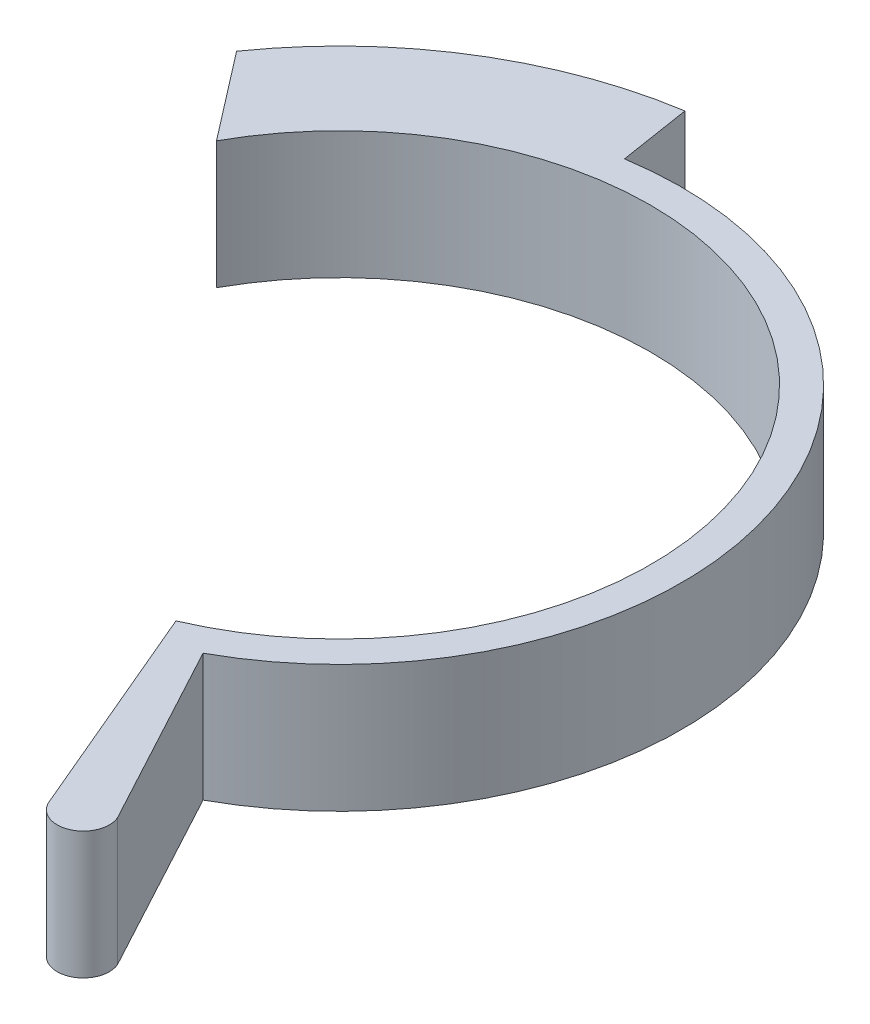
from build123d import *

# Parameters (mm, degrees)
RESSALTO_EXTRUS_O1_DEPTH = 12.26


with BuildPart() as part:
    # Esboço1 → Ressalto-extrusão1 (new body)
    with BuildSketch(Plane(origin=(0, 0, 0), x_dir=(1, 0, 0), z_dir=(0, 1, 0))):
        with BuildLine():
            Line((11.823645173, -27.571750304), (12.993920826, -30.334106573))
            Line((12.993920826, -30.334106573), (20.795690346, -48.749654144))
            ThreePointArc((20.795690346, -48.749654144), (24.072464244, -50.130779062), (25.453589161, -46.854005164))
            Line((25.453589161, -46.854005164), (25.198608413, -46.380200094))
            Line((25.198608413, -46.380200094), (15.823293166, -28.958995034))
            ThreePointArc((15.823293166, -28.958995034), (21.396881696, -25.123165678), (26.071005915, -20.231229586))
            ThreePointArc((26.071005915, -20.231229586), (26.997061933, -18.977846216), (27.862912529, -17.68214086))
            ThreePointArc((27.862912529, -17.68214086), (31.468158773, 9.937554199), (12.654282119, 30.477354611))
            ThreePointArc((12.654282119, 30.477354611), (3.9115652, 32.767356587), (-5.124534224, 32.599680198))
            Line((-5.124534224, 32.599680198), (-6.211556636, 39.514763876))
            ThreePointArc((-6.211556636, 39.514763876), (-21.202255924, 33.9184956), (-32.800073698, 22.894435249))
            Line((-32.800073698, 22.894435249), (-28.26846637, 17.015835516))
            Line((-28.26846637, 17.015835516), (-26.290601135, 14.450062005))
            ThreePointArc((-26.290601135, 14.450062005), (22.221192163, 20.154865886), (11.823645173, -27.571750304))
        make_face()
    extrude(amount=RESSALTO_EXTRUS_O1_DEPTH)


solid = part.part
